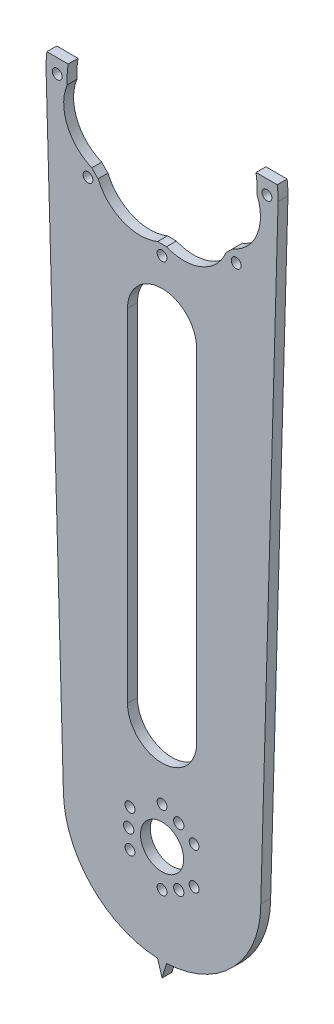
from build123d import *

# Parameters (mm, degrees)
SKETCH_3_R      = 2
SKETCH_3_R_2    = 2.08
SKETCH_3_R_3    = 8.75
EXTRUDE_1_DEPTH = 4


with BuildPart() as part:
    # 草图3 → 凸台-拉伸1 (new body)
    with BuildSketch(Plane.XY):
        with BuildLine():
            Line((-38.071041638, 58.740907862), (-46.673377973, 58.740907862))
            ThreePointArc((-46.673377973, 58.740907862), (-46.936210234, 55.880701084), (-47.023930078, 53.009783315))
            Line((-47.023930078, 53.009783315), (-40, -196.990216688))
            ThreePointArc((-40, -196.990216688), (-28.917733212, -224.626509961), (-1.811764706, -236.94916448))
            Line((-1.811764706, -236.94916448), (0, -242.990216688))
            Line((0, -242.990216688), (1.811764706, -236.94916448))
            ThreePointArc((1.811764706, -236.94916448), (28.917733212, -224.626509961), (40, -196.990216688))
            Line((40, -196.990216688), (47.023930078, 53.009783315))
            ThreePointArc((47.023930078, 53.009783315), (46.936210234, 55.880701084), (46.673377973, 58.740907862))
            Line((46.673377973, 58.740907862), (38.071041638, 58.740907862))
            ThreePointArc((38.071041638, 58.740907862), (38.449556599, 54.979960288), (38.457440916, 51.200021389))
            ThreePointArc((38.457440916, 51.200021389), (38.457808554, 37.081210633), (28.474561686, 27.097443846))
            ThreePointArc((28.474561686, 27.097443846), (27.22431994, 25.786881122), (25.913822328, 24.536571126))
            ThreePointArc((25.913822328, 24.536571126), (15.93057546, 14.552804338), (1.811764704, 14.5524367))
            Line((1.811764704, 14.5524367), (-1.811764704, 14.5524367))
            ThreePointArc((-1.811764704, 14.5524367), (-15.93057546, 14.552804338), (-25.913822328, 24.536571126))
            ThreePointArc((-25.913822328, 24.536571126), (-27.22431994, 25.786881122), (-28.474561686, 27.097443846))
            ThreePointArc((-28.474561686, 27.097443846), (-38.457808554, 37.081210633), (-38.457440916, 51.200021389))
            ThreePointArc((-38.457440916, 51.200021389), (-38.449556599, 54.979960288), (-38.071041638, 58.740907862))
        make_face()
        with Locations((0, 10.509783315)):
            Circle(SKETCH_3_R, mode=Mode.SUBTRACT)
        with Locations((-30.0520382, 22.957745114)):
            Circle(SKETCH_3_R, mode=Mode.SUBTRACT)
        with Locations((-42.5, 53.009783315)):
            Circle(SKETCH_3_R, mode=Mode.SUBTRACT)
        with Locations((30.0520382, 22.957745114)):
            Circle(SKETCH_3_R, mode=Mode.SUBTRACT)
        with Locations((0, -211.990216688)):
            Circle(SKETCH_3_R, mode=Mode.SUBTRACT)
        with Locations((-12.990381057, -204.490216688)):
            Circle(SKETCH_3_R, mode=Mode.SUBTRACT)
        with Locations((-12.990381057, -189.490216688)):
            Circle(SKETCH_3_R, mode=Mode.SUBTRACT)
        with Locations((0, -181.990216688)):
            Circle(SKETCH_3_R, mode=Mode.SUBTRACT)
        with Locations((12.990381057, -189.490216688)):
            Circle(SKETCH_3_R, mode=Mode.SUBTRACT)
        with Locations((12.990381057, -204.490216688)):
            Circle(SKETCH_3_R, mode=Mode.SUBTRACT)
        with Locations((-13.53, -196.990216688)):
            Circle(SKETCH_3_R_2, mode=Mode.SUBTRACT)
        with Locations((6.765, -185.272892975)):
            Circle(SKETCH_3_R_2, mode=Mode.SUBTRACT)
        with Locations((6.765, -208.707540401)):
            Circle(SKETCH_3_R_2, mode=Mode.SUBTRACT)
        with Locations((0, -196.990216688)):
            Circle(SKETCH_3_R_3, mode=Mode.SUBTRACT)
        with Locations(Location((42.5, 53.009783315, 0), (0, 0, 180))):
            Circle(SKETCH_3_R, mode=Mode.SUBTRACT)
        with BuildLine():
            Line((-14, -153.564151609), (-14, -15.006038041))
            ThreePointArc((-14, -15.006038041), (0, -1.006038041), (14, -15.006038041))
            Line((14, -15.006038041), (14, -153.564151609))
            ThreePointArc((14, -153.564151609), (0, -167.564151609), (-14, -153.564151609))
        make_face(mode=Mode.SUBTRACT)
    extrude(amount=EXTRUDE_1_DEPTH)


solid = part.part
